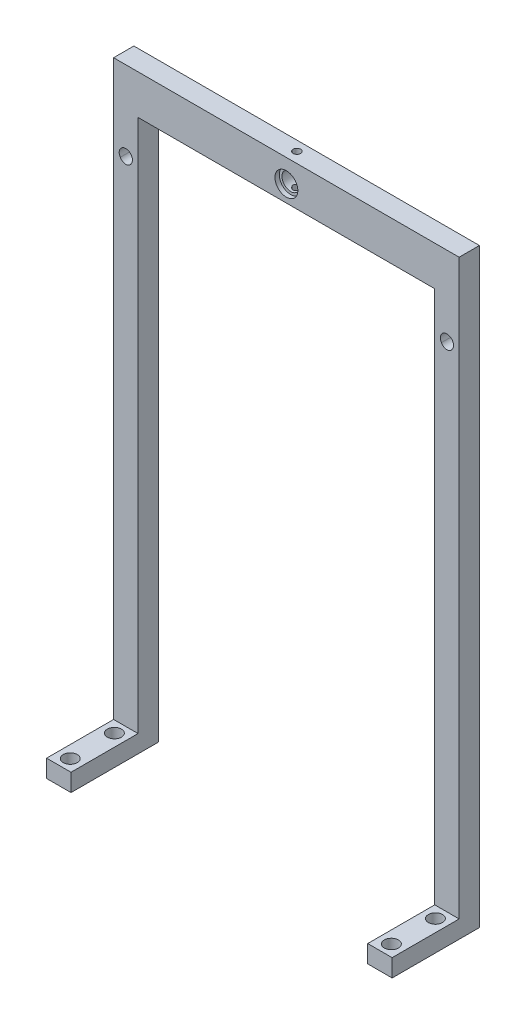
from build123d import *

# Parameters (mm, degrees)
SKETCH1_W           = 99.5426
SKETCH1_H           = 5.842
BOSS_EXTRUDE1_DEPTH = 170.18
SKETCH2_W           = 85.471
SKETCH2_H           = 158.8
CUT_EXTRUDE1_DEPTH  = 232.802638094
SKETCH3_W           = 7.0358
SKETCH3_H           = 5.08
BOSS_EXTRUDE2_DEPTH = 19.304
SKETCH4_R           = 2.032
CUT_EXTRUDE2_DEPTH  = 235.986581553
SKETCH5_R           = 2.54
CUT_EXTRUDE3_DEPTH  = 233.531671991
SKETCH7_R           = 3.302
CUT_EXTRUDE4_DEPTH  = 1.27
SKETCH10_R          = 1.0795
CUT_EXTRUDE7_DEPTH  = 239.583142552
SKETCH11_R          = 1.778
CUT_EXTRUDE8_DEPTH  = 233.531672065
SKETCH9_R           = 1.905
CUT_EXTRUDE6_DEPTH  = 233.531672065


with BuildPart() as part:
    # Sketch1 → Boss-Extrude1 (new body)
    with BuildSketch(Plane(origin=(0, 0, 0), x_dir=(1, 0, 0), z_dir=(0, 1, 0))):
        with Locations((-107.509028278, 53.855595943)):
            Rectangle(SKETCH1_W, SKETCH1_H)
    extrude(amount=BOSS_EXTRUDE1_DEPTH)

    # Sketch2 → Cut-Extrude1 (cut, through all)
    with BuildSketch(Plane.XY.offset(-50.934595943)):
        with Locations((-107.509028278, 79.4)):
            Rectangle(SKETCH2_W, SKETCH2_H)
    extrude(amount=-CUT_EXTRUDE1_DEPTH, mode=Mode.SUBTRACT)

    # Sketch3 → Boss-Extrude2 (add)
    with BuildSketch(Plane.XY.offset(-50.934595943)):
        with Locations((-153.762428278, 2.54)):
            Rectangle(SKETCH3_W, SKETCH3_H)
        with Locations((-61.255628278, 2.54)):
            Rectangle(SKETCH3_W, SKETCH3_H)
    extrude(amount=BOSS_EXTRUDE2_DEPTH)

    # Sketch4 → Cut-Extrude2 (cut, through all)
    with BuildSketch(Plane(origin=(0, 5.08, 0), x_dir=(1, 0, 0), z_dir=(0, 1, 0))):
        with Locations(Location((-153.762428278, 34.932595943, 0), (0, 0, 180))):
            Circle(SKETCH4_R)
        with Locations(Location((-153.762428278, 47.632595943, 0), (0, 0, 180))):
            Circle(SKETCH4_R)
        with Locations(Location((-61.255628278, 34.932595943, 0), (0, 0, 180))):
            Circle(SKETCH4_R)
        with Locations(Location((-61.255628278, 47.632595943, 0), (0, 0, 180))):
            Circle(SKETCH4_R)
    extrude(amount=-CUT_EXTRUDE2_DEPTH, mode=Mode.SUBTRACT)

    # Sketch5 → Cut-Extrude3 (cut, through all)
    with BuildSketch(Plane.XY.offset(-50.934595943)):
        with Locations((-107.509028278, 163.576)):
            Circle(SKETCH5_R)
    extrude(amount=-CUT_EXTRUDE3_DEPTH, mode=Mode.SUBTRACT)

    # Sketch7 → Cut-Extrude4 (cut)
    with BuildSketch(Plane.XY.offset(-50.934595943)):
        with Locations((-107.509028278, 163.576)):
            Circle(SKETCH7_R)
    extrude(amount=-CUT_EXTRUDE4_DEPTH, mode=Mode.SUBTRACT)

    # Sketch10 → Cut-Extrude7 (cut, through all)
    with BuildSketch(Plane(origin=(0, 170.18, 0), x_dir=(1, 0, 0), z_dir=(0, 1, 0))):
        with Locations(Location((-107.509028278, 53.982595943, 0), (0, 0, 270))):
            Circle(SKETCH10_R)
    extrude(amount=-CUT_EXTRUDE7_DEPTH, mode=Mode.SUBTRACT)

    # Sketch11 → Cut-Extrude8 (cut, through all)
    with BuildSketch(Plane.XY.offset(-50.934595943)):
        with Locations((-153.762428278, 147.116)):
            Circle(SKETCH11_R)
        with Locations((-61.255628278, 147.116)):
            Circle(SKETCH11_R)
    extrude(amount=-CUT_EXTRUDE8_DEPTH, mode=Mode.SUBTRACT)

    # Sketch9 → Cut-Extrude6 (cut, through all)
    with BuildSketch(Plane.XY.offset(-50.934595943)):
        with Locations((-153.762428278, 147.37)):
            Circle(SKETCH9_R)
        with Locations((-61.255628278, 147.37)):
            Circle(SKETCH9_R)
    extrude(amount=-CUT_EXTRUDE6_DEPTH, mode=Mode.SUBTRACT)


solid = part.part
